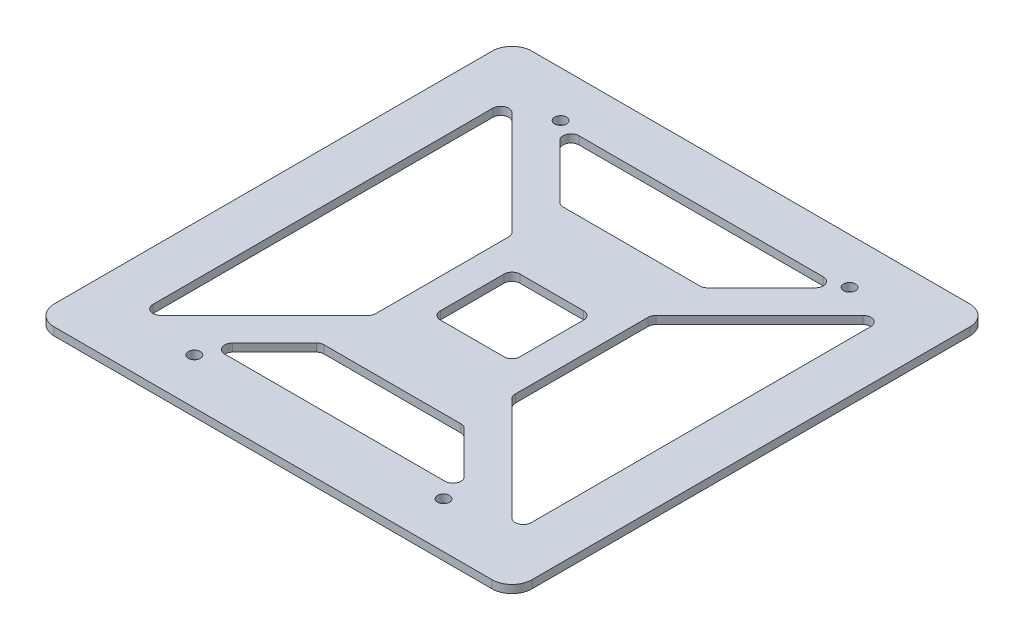
from build123d import *

# Parameters (mm, degrees)
SKETCH1_W           = 120
SKETCH1_H           = 120
BOSS_EXTRUDE1_DEPTH = 2
FILLET1_R           = 5
FILLET2_R           = 5
FILLET3_R           = 5
FILLET4_R           = 5
SKETCH2_W           = 20
SKETCH2_H           = 20
CUT_EXTRUDE1_DEPTH  = 10
FILLET5_R           = 2
FILLET6_R           = 2
SKETCH4_R           = 1.5
CUT_EXTRUDE2_DEPTH  = 10


with BuildPart() as part:
    # Sketch1 → Boss-Extrude1 (new body)
    with BuildSketch(Plane(origin=(0, 0, 0), x_dir=(1, 0, 0), z_dir=(0, 1, 0))):
        Rectangle(SKETCH1_W, SKETCH1_H)
    extrude(amount=BOSS_EXTRUDE1_DEPTH)

    # Fillet1
    fillet1_edges = [part.edges().sort_by_distance(p)[0] for p in [
        (60, 1, 60),
    ]]
    fillet(fillet1_edges, radius=FILLET1_R)

    # Fillet2
    fillet2_edges = [part.edges().sort_by_distance(p)[0] for p in [
        (-60, 1, 60),
    ]]
    fillet(fillet2_edges, radius=FILLET2_R)

    # Fillet3
    fillet3_edges = [part.edges().sort_by_distance(p)[0] for p in [
        (60, 1, -60),
    ]]
    fillet(fillet3_edges, radius=FILLET3_R)

    # Fillet4
    fillet4_edges = [part.edges().sort_by_distance(p)[0] for p in [
        (-60, 1, -60),
    ]]
    fillet(fillet4_edges, radius=FILLET4_R)

    # Sketch2 → Cut-Extrude1 (cut)
    with BuildSketch(Plane(origin=(0, 2, 0), x_dir=(1, 0, 0), z_dir=(0, 1, 0))):
        Polygon((-47.5, -47.5), (-17.5, -17.5), (-17.5, 17.5), (-47.5, 47.5), align=None)
        Polygon((18, -30), (-18, -30), (-32.5, -44.5), (32.5, -44.5), align=None)
        Rectangle(SKETCH2_W, SKETCH2_H)
        Polygon((35.5, 47.5), (-35.5, 47.5), (-18, 30), (18, 30), align=None)
        Polygon((17.5, -17.5), (47.5, -47.5), (47.5, 47.5), (17.5, 17.5), align=None)
    extrude(amount=-CUT_EXTRUDE1_DEPTH, mode=Mode.SUBTRACT)

    # Fillet5
    fillet5_edges = [part.edges().sort_by_distance(p)[0] for p in [
        (-35.5, 1, -47.5),
        (35.5, 1, -47.5),
    ]]
    fillet(fillet5_edges, radius=FILLET5_R)

    # Fillet6
    fillet6_edges = [part.edges().sort_by_distance(p)[0] for p in [
        (-18, 1, -30),
        (18, 1, -30),
        (-32.5, 1, 44.5),
        (-18, 1, 30),
        (18, 1, 30),
        (32.5, 1, 44.5),
        (10, 1, 10),
        (-10, 1, 10),
        (-10, 1, -10),
        (10, 1, -10),
        (-17.5, 1, -17.5),
        (-17.5, 1, 17.5),
        (-47.5, 1, 47.5),
        (-47.5, 1, -47.5),
        (47.5, 1, -47.5),
        (47.5, 1, 47.5),
        (17.5, 1, 17.5),
        (17.5, 1, -17.5),
    ]]
    fillet(fillet6_edges, radius=FILLET6_R)

    # Sketch4 → Cut-Extrude2 (cut)
    with BuildSketch(Plane.XZ):
        with Locations(Location((-36.293024341, -48.5, 0), (0, 0, 270))):
            Circle(SKETCH4_R)
        with Locations(Location((-31.293024341, 48.5, 0), (0, 0, 270))):
            Circle(SKETCH4_R)
        with Locations(Location((31.293024341, 48.5, 0), (0, 0, 270))):
            Circle(SKETCH4_R)
        with Locations(Location((36.293024341, -48.5, 0), (0, 0, 270))):
            Circle(SKETCH4_R)
    extrude(amount=-CUT_EXTRUDE2_DEPTH, mode=Mode.SUBTRACT)


solid = part.part
